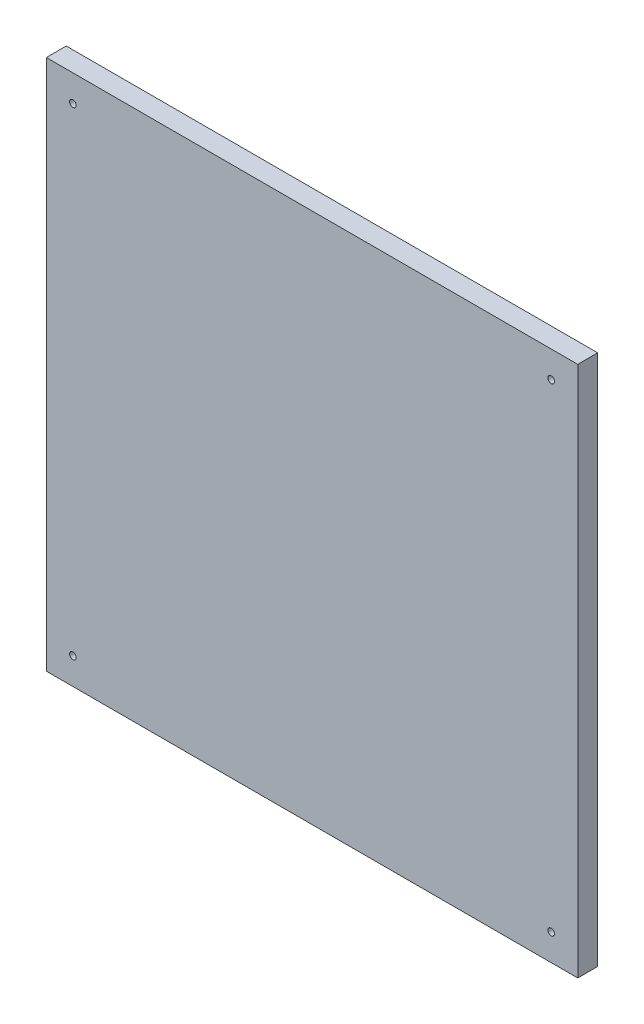
from build123d import *

# Parameters (mm, degrees)
SKETCH1_W           = 800
SKETCH1_H           = 800
BOSS_EXTRUDE1_DEPTH = 30
SKETCH2_R           = 5
CUT_EXTRUDE1_DEPTH  = 10
SKETCH4_R           = 5
CUT_EXTRUDE2_DEPTH  = 10
SKETCH6_R           = 5
CUT_EXTRUDE3_DEPTH  = 10
SKETCH8_R           = 5
CUT_EXTRUDE4_DEPTH  = 10


with BuildPart() as part:
    # Sketch1 → Boss-Extrude1 (new body)
    with BuildSketch(Plane.XY):
        Rectangle(SKETCH1_W, SKETCH1_H)
    extrude(amount=-BOSS_EXTRUDE1_DEPTH)

    # Sketch2 → Cut-Extrude1 (cut)
    with BuildSketch(Plane.XY):
        with Locations((360, 360)):
            Circle(SKETCH2_R)
    extrude(amount=-CUT_EXTRUDE1_DEPTH, mode=Mode.SUBTRACT)

    # Sketch4 → Cut-Extrude2 (cut)
    with BuildSketch(Plane.XY):
        with Locations((-360, 360)):
            Circle(SKETCH4_R)
    extrude(amount=-CUT_EXTRUDE2_DEPTH, mode=Mode.SUBTRACT)

    # Sketch6 → Cut-Extrude3 (cut)
    with BuildSketch(Plane.XY):
        with Locations((-360, -360)):
            Circle(SKETCH6_R)
    extrude(amount=-CUT_EXTRUDE3_DEPTH, mode=Mode.SUBTRACT)

    # Sketch8 → Cut-Extrude4 (cut)
    with BuildSketch(Plane.XY):
        with Locations((360, -360)):
            Circle(SKETCH8_R)
    extrude(amount=-CUT_EXTRUDE4_DEPTH, mode=Mode.SUBTRACT)


solid = part.part
